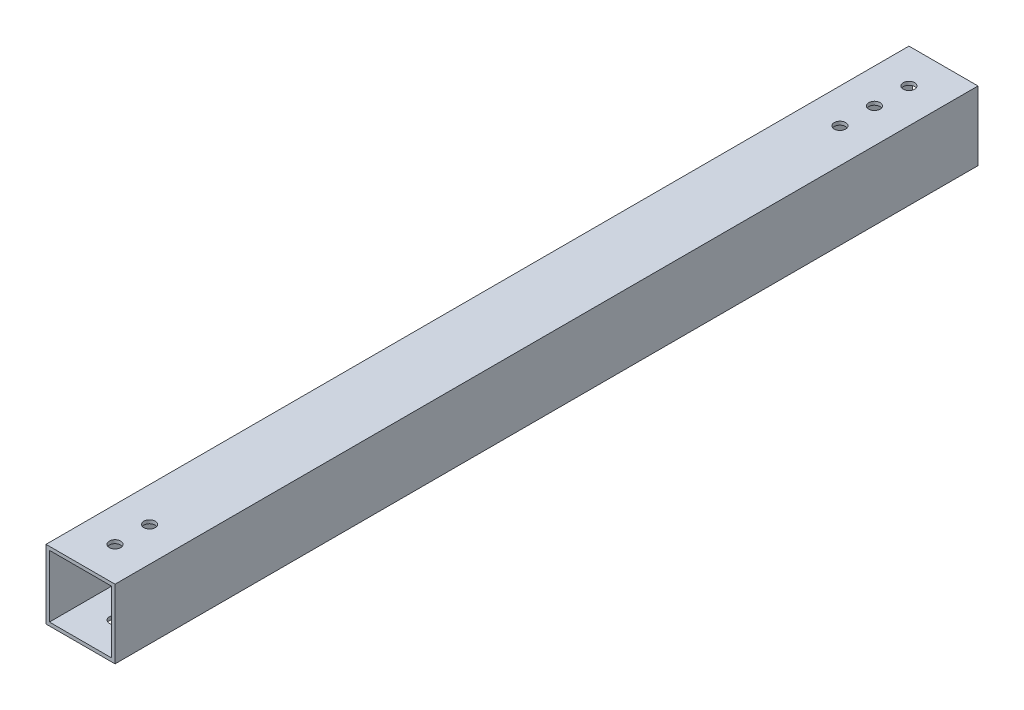
from build123d import *

# Parameters (mm, degrees)
SKETCH_1_W          = 20
SKETCH_1_H          = 20
SKETCH_1_W_2        = 18
SKETCH_1_H_2        = 18
EXTRUDE_1_DEPTH     = 250
SKETCH_2_R          = 1.65
CUT_EXTRUDE_1_DEPTH = 251.99800796


with BuildPart() as part:
    # 草图1 → 凸台-拉伸1 (new body)
    with BuildSketch(Plane.XY):
        Rectangle(SKETCH_1_W, SKETCH_1_H)
        Rectangle(SKETCH_1_W_2, SKETCH_1_H_2, mode=Mode.SUBTRACT)
    extrude(amount=EXTRUDE_1_DEPTH)

    # 草图2 → 切除-拉伸1 (cut, through all)
    with BuildSketch(Plane(origin=(0, 10, 0), x_dir=(1, 0, 0), z_dir=(0, 1, 0))):
        with Locations(Location((0, -10, 0), (0, 0, 270))):
            Circle(SKETCH_2_R)
        with Locations(Location((0, -20, 0), (0, 0, 270))):
            Circle(SKETCH_2_R)
        with Locations(Location((0, -30, 0), (0, 0, 270))):
            Circle(SKETCH_2_R)
        with Locations(Location((0, -240, 0), (0, 0, 270))):
            Circle(SKETCH_2_R)
        with Locations(Location((0, -230, 0), (0, 0, 270))):
            Circle(SKETCH_2_R)
    extrude(amount=-CUT_EXTRUDE_1_DEPTH, mode=Mode.SUBTRACT)


solid = part.part
